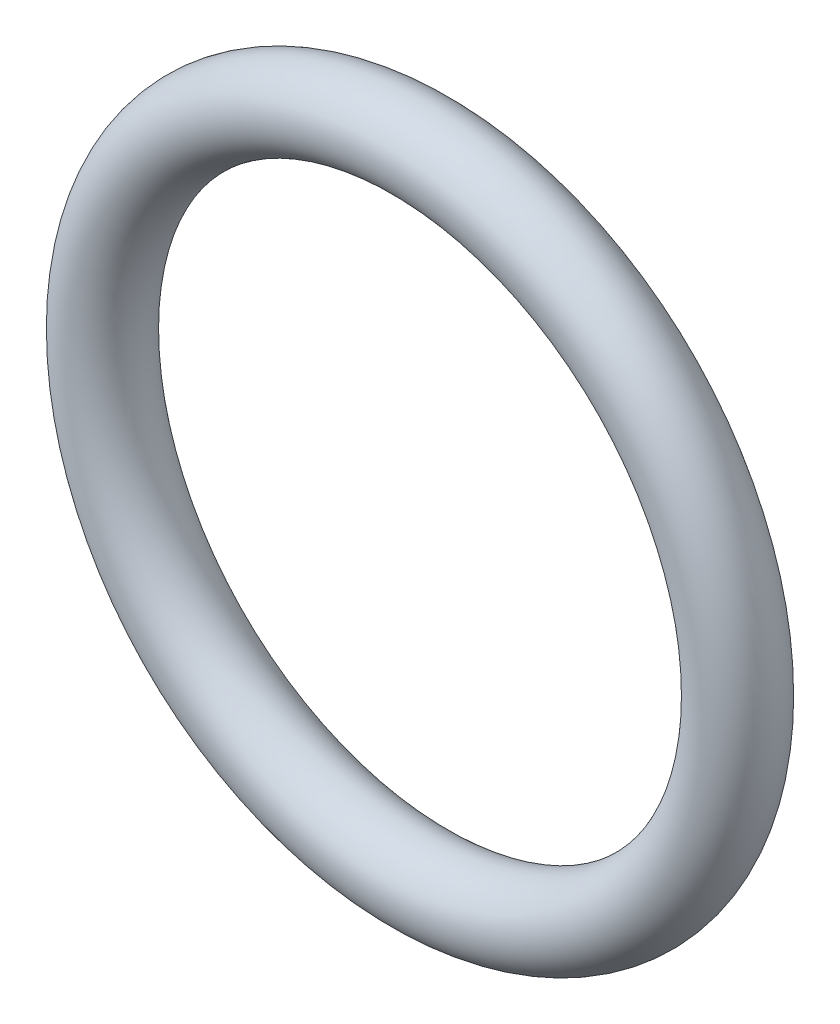
from build123d import *

# Parameters (mm, degrees)
SKETCH4_R = 2


with BuildPart() as part:
    # Sweep1: sweep along a path in Sketch3
    with BuildLine(Plane.XY) as sweep1_path:
        CenterArc((0, 0), 16, 0, 360)
    # Sketch4 → Sweep1 (sweep)
    with BuildSketch(Plane(origin=(0, 0, 0), x_dir=(1, 0, 0), z_dir=(0, 1, 0))):
        with Locations((-16, 0)):
            Circle(SKETCH4_R)
    sweep(path=sweep1_path.line)


solid = part.part
